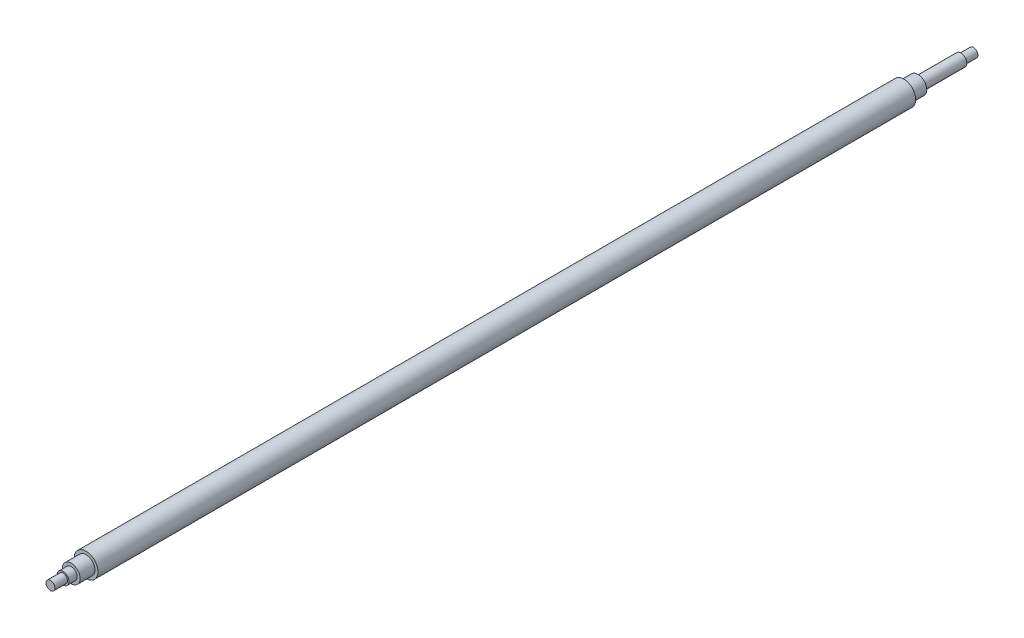
from build123d import *


with BuildPart() as part:
    # Schizzo2 → Rivoluzione2 (revolve)
    with BuildSketch(Plane(origin=(0, 0, 0), x_dir=(0, 0, -1), z_dir=(1, 0, 0)), mode=Mode.PRIVATE) as rivoluzione2_sk:
        Polygon((0, 0), (0, 3), (8.5, 3), (8.5, 4), (14, 4), (14, 6), (24, 6), (24, 8), (575, 8), (575, 6), (584.5, 6), (584.5, 4), (613.5, 4), (613.5, 3), (622, 3), (622, 0), align=None)
    revolve(rivoluzione2_sk.sketch.rotate(Axis((0, 0, 0), (0, 0, -1)), 90), axis=Axis((0, 0, 0), (0, 0, -1)))


solid = part.part
